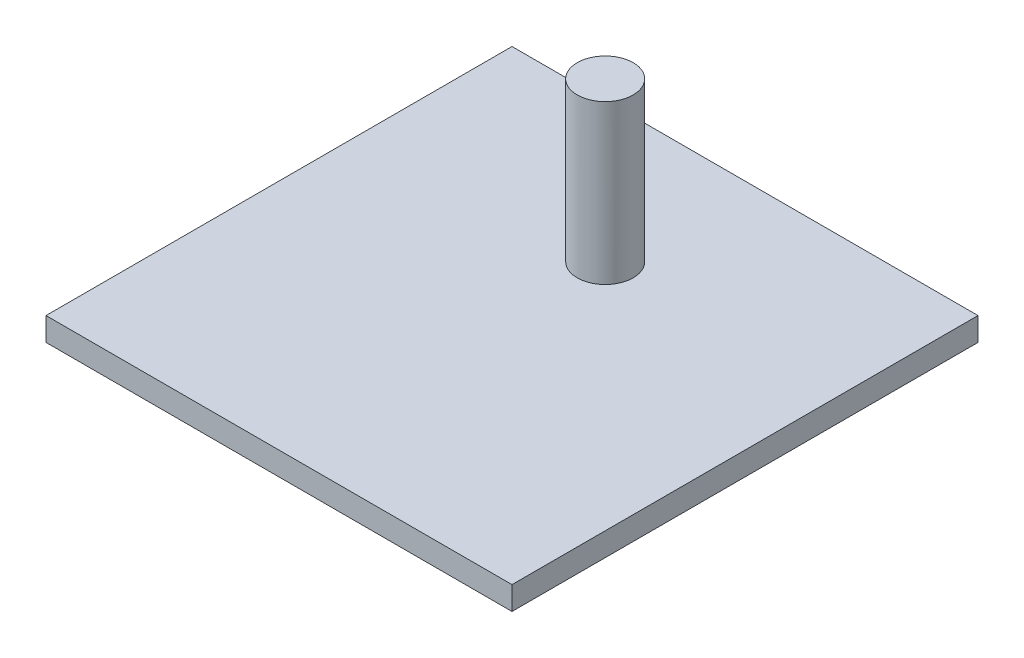
from build123d import *

# Parameters (mm, degrees)
SKETCH1_W           = 200
SKETCH1_H           = 200
BOSS_EXTRUDE1_DEPTH = 10
SKETCH2_R           = 12
BOSS_EXTRUDE2_DEPTH = 68


with BuildPart() as part:
    # Sketch1 → Boss-Extrude1 (new body)
    with BuildSketch(Plane(origin=(0, 0, 0), x_dir=(1, 0, 0), z_dir=(0, 1, 0))):
        with Locations((100, 100)):
            Rectangle(SKETCH1_W, SKETCH1_H)
    extrude(amount=BOSS_EXTRUDE1_DEPTH)

    # Sketch2 → Boss-Extrude2 (add)
    with BuildSketch(Plane(origin=(0, 10, 0), x_dir=(-1, 0, 0), z_dir=(0, 1, 0))):
        with Locations(Location((-100, -140, 0), (0, 0, 270))):
            Circle(SKETCH2_R)
    extrude(amount=BOSS_EXTRUDE2_DEPTH)


solid = part.part
